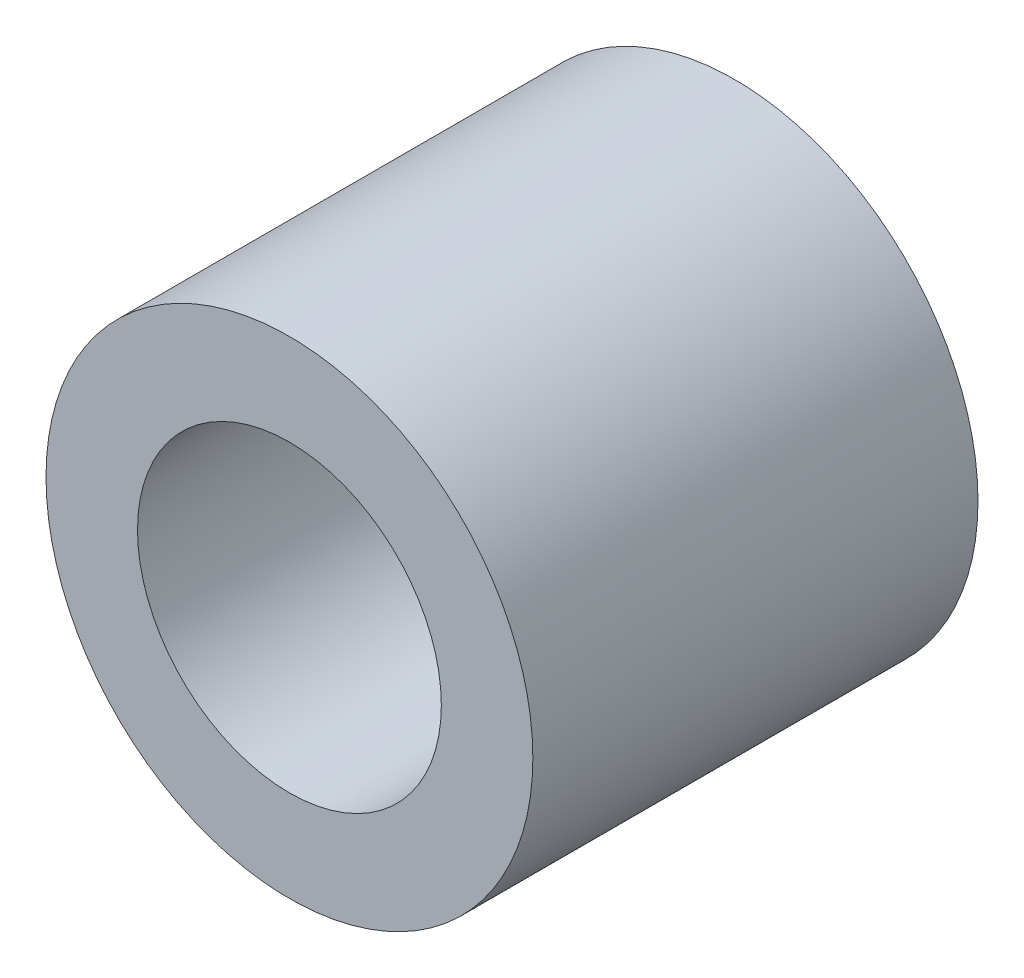
from build123d import *

# Parameters (mm, degrees)
SKETCH1_R           = 11.1125
SKETCH1_R_2         = 6.9342
BOSS_EXTRUDE1_DEPTH = 20.32


with BuildPart() as part:
    # Sketch1 → Boss-Extrude1 (new body)
    with BuildSketch(Plane.XY):
        Circle(SKETCH1_R)
        Circle(SKETCH1_R_2, mode=Mode.SUBTRACT)
    extrude(amount=BOSS_EXTRUDE1_DEPTH)


solid = part.part
